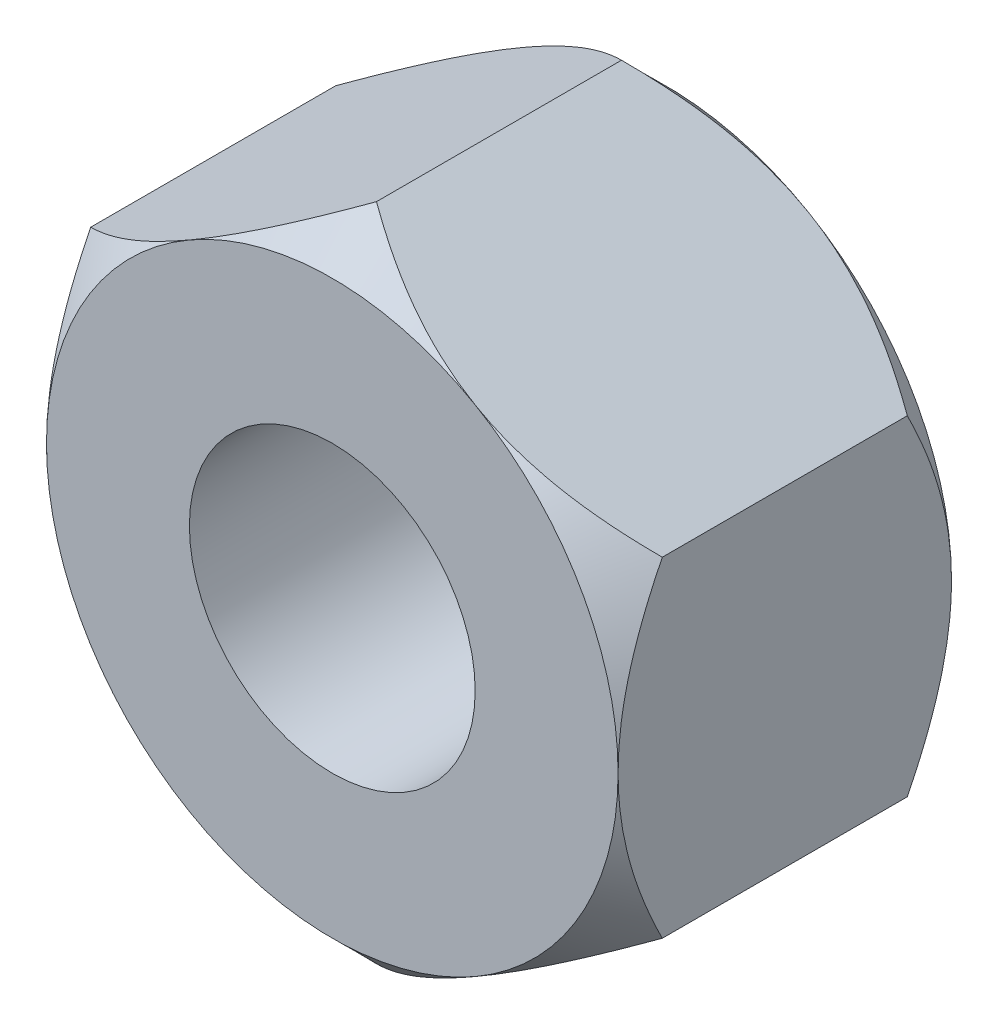
from build123d import *

# Parameters (mm, degrees)
SKETCH1_R               = 1.5
BOSS_EXTRUDE1_DEPTH     = 3.5
SKETCH2_OUTSIDE_W       = 23.494
SKETCH2_OUTSIDE_H       = 24.422
SKETCH2_OUTSIDE_R       = 3
CUT_EXTRUDE2_DEPTH      = 6.766281297
CUT_EXTRUDE2_DRAFT      = -45
MIRROR1_COPY_1_SKETCH_W = 23.494
MIRROR1_COPY_1_SKETCH_H = 24.422
MIRROR1_COPY_1_SKETCH_R = 3
MIRROR1_COPY_1_DEPTH    = 6.766281297
MIRROR1_COPY_1_DRAFT    = -45


with BuildPart() as part:
    # Sketch1 → Boss-Extrude1 (new body)
    with BuildSketch(Plane.XY):
        Polygon((0, -3.464101615), (3, -1.732050808), (3, 1.732050808), (0, 3.464101615), (-3, 1.732050808), (-3, -1.732050808), align=None)
        Circle(SKETCH1_R, mode=Mode.SUBTRACT)
    extrude(amount=BOSS_EXTRUDE1_DEPTH)


with BuildPart() as cut_extrude2_tool:
    # Sketch2 outside → Cut-Extrude2 (with draft: the straight prism first)
    with BuildSketch(Plane.XY.offset(3.5)):
        Rectangle(SKETCH2_OUTSIDE_W, SKETCH2_OUTSIDE_H)
        Circle(SKETCH2_OUTSIDE_R, mode=Mode.SUBTRACT)
    extrude(amount=-CUT_EXTRUDE2_DEPTH)
    # Cut-Extrude2: the draft: its side faces are tilted about the plane it starts from
    cut_extrude2_sides = [cut_extrude2_tool.faces().sort_by_distance(p)[0] for p in [
        (0, -12.211, 0.116859351),
        (11.747, 0, 0.116859351),
        (0, 12.211, 0.116859351),
        (-11.747, 0, 0.116859351),
        (-3, 0, 0.116859351),
    ]]
    draft(cut_extrude2_sides, Plane.XY.offset(3.5), CUT_EXTRUDE2_DRAFT)


with BuildPart() as part_1:
    add(part.part)

    # Cut-Extrude2: cut by cut_extrude2_tool
    add(cut_extrude2_tool.part, mode=Mode.SUBTRACT)


with BuildPart() as mirror1_copy_1_tool:
    # Mirror1 copy 1 sketch → Mirror1 copy 1 (with draft: the straight prism first)
    with BuildSketch(Plane(origin=(0, 0, 0), x_dir=(1, 0, 0), z_dir=(0, 0, -1))):
        Rectangle(MIRROR1_COPY_1_SKETCH_W, MIRROR1_COPY_1_SKETCH_H)
        Circle(MIRROR1_COPY_1_SKETCH_R, mode=Mode.SUBTRACT)
    extrude(amount=-MIRROR1_COPY_1_DEPTH)
    # Mirror1 copy 1: the draft: its side faces are tilted about the plane it starts from
    mirror1_copy_1_sides = [mirror1_copy_1_tool.faces().sort_by_distance(p)[0] for p in [
        (0, -12.211, 3.383140649),
        (11.747, 0, 3.383140649),
        (0, 12.211, 3.383140649),
        (-11.747, 0, 3.383140649),
        (-3, 0, 3.383140649),
    ]]
    draft(mirror1_copy_1_sides, Plane(origin=(0, 0, 0), x_dir=(1, 0, 0), z_dir=(0, 0, -1)), MIRROR1_COPY_1_DRAFT)


with BuildPart() as part_2:
    add(part_1.part)

    # Mirror1 copy 1: cut by mirror1_copy_1_tool
    add(mirror1_copy_1_tool.part, mode=Mode.SUBTRACT)


solid = part_2.part
